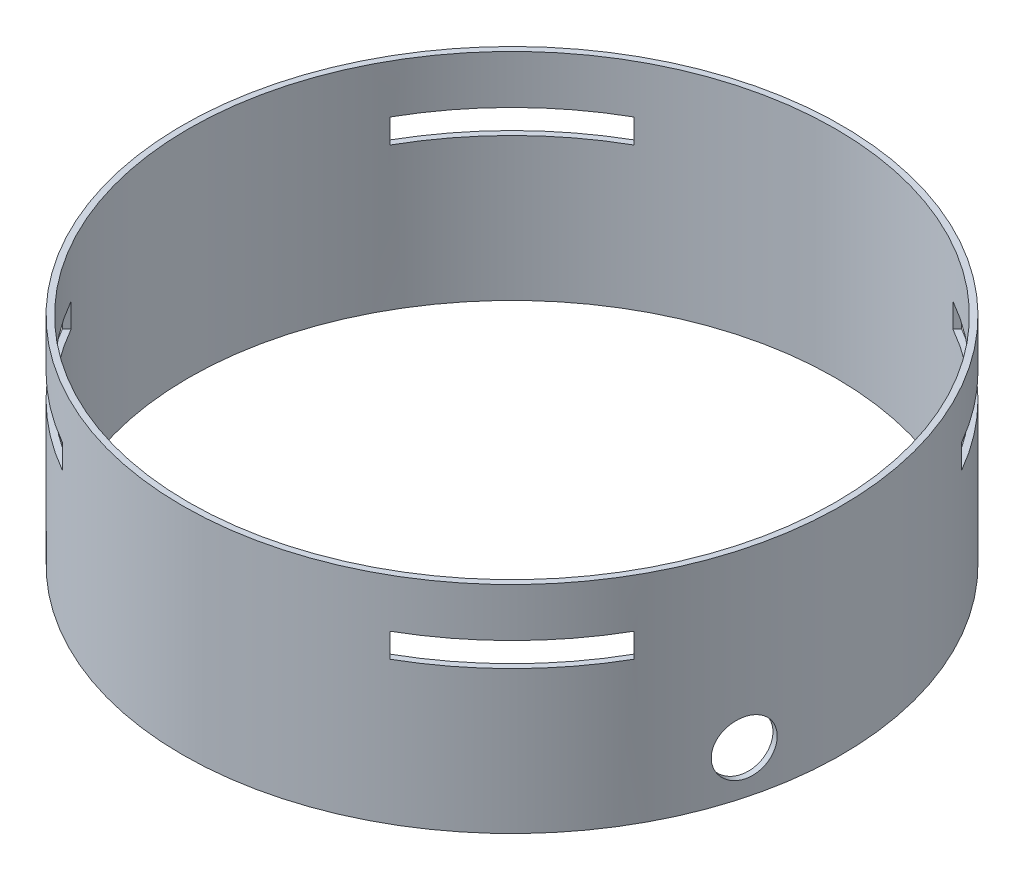
from build123d import *

# Parameters (mm, degrees)
SKETCH1_R           = 77.6224
SKETCH1_R_2         = 76.2
BOSS_EXTRUDE1_DEPTH = 25.4
SKETCH2_W           = 40.64
SKETCH2_H           = 5.715
CUT_EXTRUDE1_DEPTH  = 113.674903876
CIRPATTERN1_COUNT   = 4
SKETCH3_R           = 6.35
CUT_EXTRUDE2_DEPTH  = 6.35


with BuildPart() as part:
    # Sketch1 → Boss-Extrude1 (new, symmetric)
    with BuildSketch(Plane(origin=(0, 0, 0), x_dir=(1, 0, 0), z_dir=(0, 1, 0))):
        with Locations(Location((0, 0, 0), (0, 0, 270))):
            Circle(SKETCH1_R)
        with Locations(Location((0, 0, 0), (0, 0, 270))):
            Circle(SKETCH1_R_2, mode=Mode.SUBTRACT)
    extrude(amount=BOSS_EXTRUDE1_DEPTH, both=True)

    # Sketch2 → Cut-Extrude1 (cut, through all)
    with BuildSketch(Plane(origin=(0, 0, 0), x_dir=(0.7071067811865477, 0, 0.7071067811865475), z_dir=(-0.7071067811865475, 0, 0.7071067811865477))):
        with Locations((0, 11.1125)):
            Rectangle(SKETCH2_W, SKETCH2_H)
    cut_extrude1 = extrude(amount=-CUT_EXTRUDE1_DEPTH, mode=Mode.SUBTRACT)

    # CirPattern1: Cut-Extrude1 ×4 about axis
    cirpattern1_axis = Axis((0, 0, 0), (0, 1, 0))
    for i in range(1, CIRPATTERN1_COUNT):
        add(cut_extrude1.rotate(cirpattern1_axis, i * 360 / CIRPATTERN1_COUNT), mode=Mode.SUBTRACT)

    # Sketch3 → Cut-Extrude2 (cut)
    with BuildSketch(Plane(origin=(74.977480859, 0, 20.090155447), x_dir=(0, -1, 0), z_dir=(0.9659258262890681, 0, 0.25881904510252135))):
        with Locations(Location((15.24, 0, 0), (0, 0, 90))):
            Circle(SKETCH3_R)
    extrude(amount=-CUT_EXTRUDE2_DEPTH, mode=Mode.SUBTRACT)


solid = part.part
